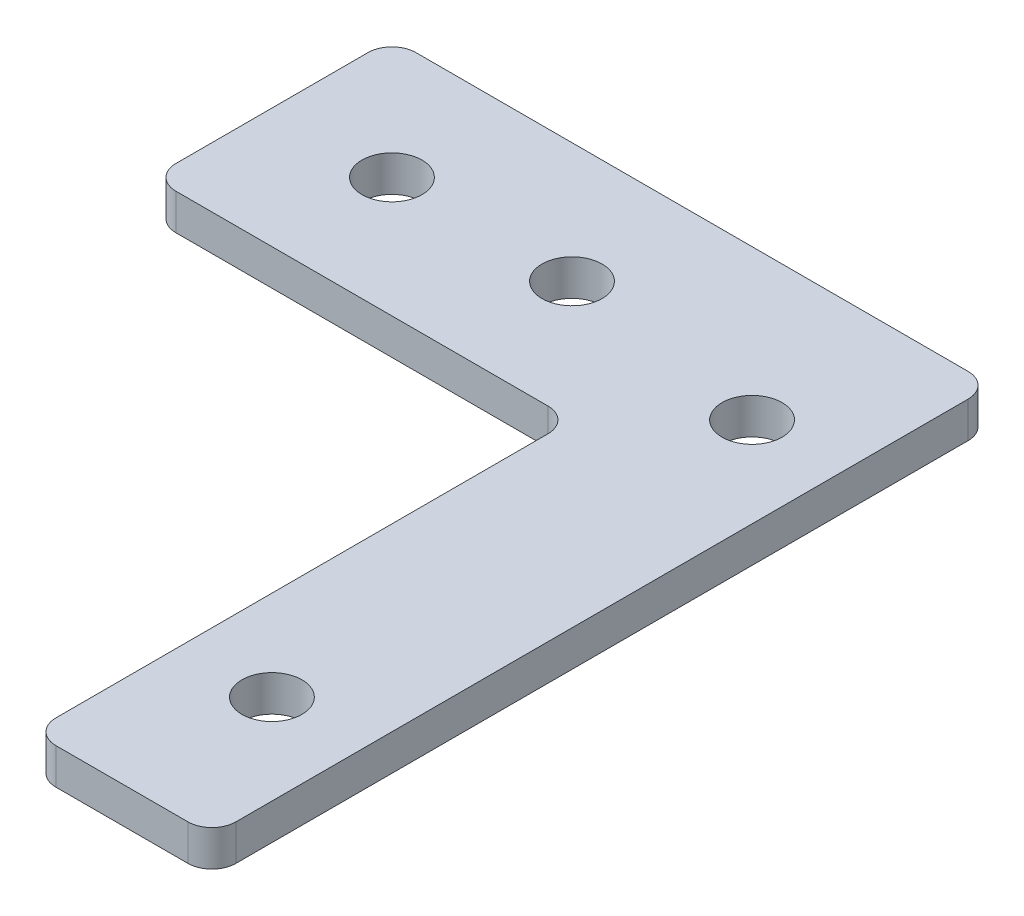
from build123d import *

# Parameters (mm, degrees)
SKETCH_1_R      = 2.5
EXTRUDE_1_DEPTH = 3


with BuildPart() as part:
    # 草图1 → 凸台-拉伸1 (new body)
    with BuildSketch(Plane(origin=(0, 0, 0), x_dir=(1, 0, 0), z_dir=(0, 1, 0))):
        with BuildLine():
            ThreePointArc((0, 2), (0.585786438, 0.585786438), (2, 0))
            Line((2, 0), (33, 0))
            ThreePointArc((33, 0), (34.414213562, -0.585786438), (35, -2))
            Line((35, -2), (35, -43))
            ThreePointArc((35, -43), (35.585786438, -44.414213562), (37, -45))
            Line((37, -45), (48, -45))
            ThreePointArc((48, -45), (49.414213562, -44.414213562), (50, -43))
            Line((50, -43), (50, 0))
            Line((50, 0), (50, 18))
            ThreePointArc((50, 18), (49.414213562, 19.414213562), (48, 20))
            Line((48, 20), (2, 20))
            ThreePointArc((2, 20), (0.585786438, 19.414213562), (0, 18))
            Line((0, 18), (0, 2))
        make_face()
        with Locations(Location((42.5, -32.5, 0), (0, 0, 270))):
            Circle(SKETCH_1_R, mode=Mode.SUBTRACT)
        with Locations(Location((10, 10, 0), (0, 0, 270))):
            Circle(SKETCH_1_R, mode=Mode.SUBTRACT)
        with Locations(Location((25, 10, 0), (0, 0, 270))):
            Circle(SKETCH_1_R, mode=Mode.SUBTRACT)
        with Locations(Location((42.5, 7.5, 0), (0, 0, 270))):
            Circle(SKETCH_1_R, mode=Mode.SUBTRACT)
    extrude(amount=EXTRUDE_1_DEPTH)


solid = part.part
